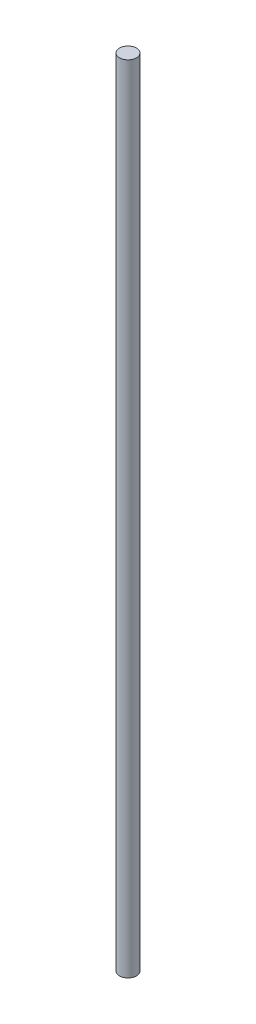
from build123d import *

# Parameters (mm, degrees)
SKETCH1_R           = 1.6
BOSS_EXTRUDE1_DEPTH = 150


with BuildPart() as part:
    # Sketch1 → Boss-Extrude1 (new body)
    with BuildSketch(Plane(origin=(0, 0, 0), x_dir=(1, 0, 0), z_dir=(0, 1, 0))):
        with Locations(Location((0, 0, 0), (0, 0, 270))):
            Circle(SKETCH1_R)
    extrude(amount=BOSS_EXTRUDE1_DEPTH)


solid = part.part
